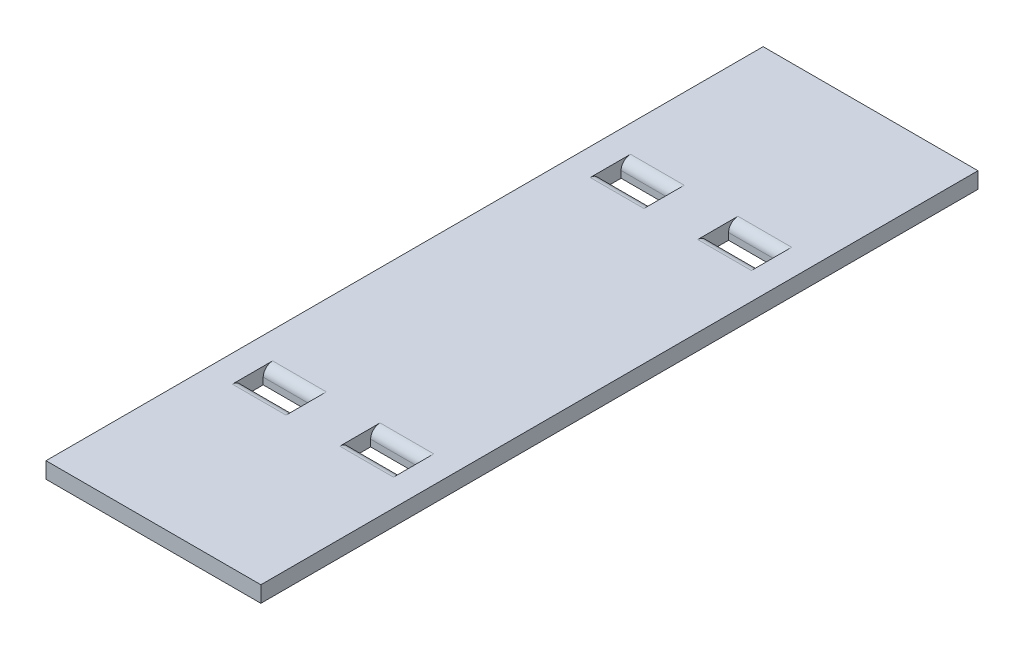
from build123d import *

# Parameters (mm, degrees)
SKETCH1_W           = 40
SKETCH1_H           = 133.5
BOSS_EXTRUDE1_DEPTH = 3
SKETCH2_R           = 6.11
BOSS_EXTRUDE2_DEPTH = 3
CUT_EXTRUDE1_REACH  = 71.94
SKETCH3_W           = 10
SKETCH3_H           = 4
FILLET2_R           = 1.75
FILLET3_R           = 1


with BuildPart() as part:
    # Sketch1 → Boss-Extrude1 (new body)
    with BuildSketch(Plane(origin=(0, 0, 0), x_dir=(1, 0, 0), z_dir=(0, 1, 0))):
        Rectangle(SKETCH1_W, SKETCH1_H)
    extrude(amount=BOSS_EXTRUDE1_DEPTH)

    # Sketch2 → Boss-Extrude2 (add)
    with BuildSketch(Plane.XZ):
        with Locations(Location((10, 56.75, 0), (0, 0, 90))):
            Circle(SKETCH2_R)
        with Locations(Location((-10, 56.75, 0), (0, 0, 90))):
            Circle(SKETCH2_R)
        with Locations(Location((-10, -56.75, 0), (0, 0, 90))):
            Circle(SKETCH2_R)
        with Locations(Location((10, -56.75, 0), (0, 0, 90))):
            Circle(SKETCH2_R)
    extrude(amount=BOSS_EXTRUDE2_DEPTH)

    # Sketch3 → Cut-Extrude1 (cut, up to next)
    with BuildSketch(Plane(origin=(0, 3, 0), x_dir=(1, 0, 0), z_dir=(0, 1, 0)), mode=Mode.PRIVATE) as cut_extrude1_sk1:
        with Locations((10, 33.3125)):
            Rectangle(SKETCH3_W, SKETCH3_H)
    cut_extrude1_tool1 = extrude(cut_extrude1_sk1.sketch, amount=-CUT_EXTRUDE1_REACH, mode=Mode.PRIVATE) & part.part
    # Sketch3 → Cut-Extrude1 (cut, up to next)
    with BuildSketch(Plane(origin=(0, 3, 0), x_dir=(1, 0, 0), z_dir=(0, 1, 0)), mode=Mode.PRIVATE) as cut_extrude1_sk2:
        with Locations((-10, 33.3125)):
            Rectangle(SKETCH3_W, SKETCH3_H)
    cut_extrude1_tool2 = extrude(cut_extrude1_sk2.sketch, amount=-CUT_EXTRUDE1_REACH, mode=Mode.PRIVATE) & part.part
    # Sketch3 → Cut-Extrude1 (cut, up to next)
    with BuildSketch(Plane(origin=(0, 3, 0), x_dir=(1, 0, 0), z_dir=(0, 1, 0)), mode=Mode.PRIVATE) as cut_extrude1_sk3:
        with Locations((-10, -33.3125)):
            Rectangle(SKETCH3_W, SKETCH3_H)
    cut_extrude1_tool3 = extrude(cut_extrude1_sk3.sketch, amount=-CUT_EXTRUDE1_REACH, mode=Mode.PRIVATE) & part.part
    # Sketch3 → Cut-Extrude1 (cut, up to next)
    with BuildSketch(Plane(origin=(0, 3, 0), x_dir=(1, 0, 0), z_dir=(0, 1, 0)), mode=Mode.PRIVATE) as cut_extrude1_sk4:
        with Locations((10, -33.3125)):
            Rectangle(SKETCH3_W, SKETCH3_H)
    cut_extrude1_tool4 = extrude(cut_extrude1_sk4.sketch, amount=-CUT_EXTRUDE1_REACH, mode=Mode.PRIVATE) & part.part
    add(cut_extrude1_tool1.solids().sort_by_distance((10, 3, -33.3125))[0], mode=Mode.SUBTRACT)
    add(cut_extrude1_tool2.solids().sort_by_distance((-10, 3, -33.3125))[0], mode=Mode.SUBTRACT)
    add(cut_extrude1_tool3.solids().sort_by_distance((-10, 3, 33.3125))[0], mode=Mode.SUBTRACT)
    add(cut_extrude1_tool4.solids().sort_by_distance((10, 3, 33.3125))[0], mode=Mode.SUBTRACT)

    # Fillet2
    fillet2_edges = [part.edges().sort_by_distance(p)[0] for p in [
        (10, 3, 35.3125),
        (10, 3, 31.3125),
        (-10, 3, 35.3125),
        (-10, 3, 31.3125),
        (-10, 3, -35.3125),
        (-10, 3, -31.3125),
        (10, 3, -35.3125),
        (10, 3, -31.3125),
    ]]
    fillet(fillet2_edges, radius=FILLET2_R)

    # Fillet3
    fillet3_edges = [part.edges().sort_by_distance(p)[0] for p in [
        (10, -3, -62.86),
        (-10, -3, -62.86),
        (-10, -3, 50.64),
        (10, -3, 50.64),
    ]]
    fillet(fillet3_edges, radius=FILLET3_R)


solid = part.part
